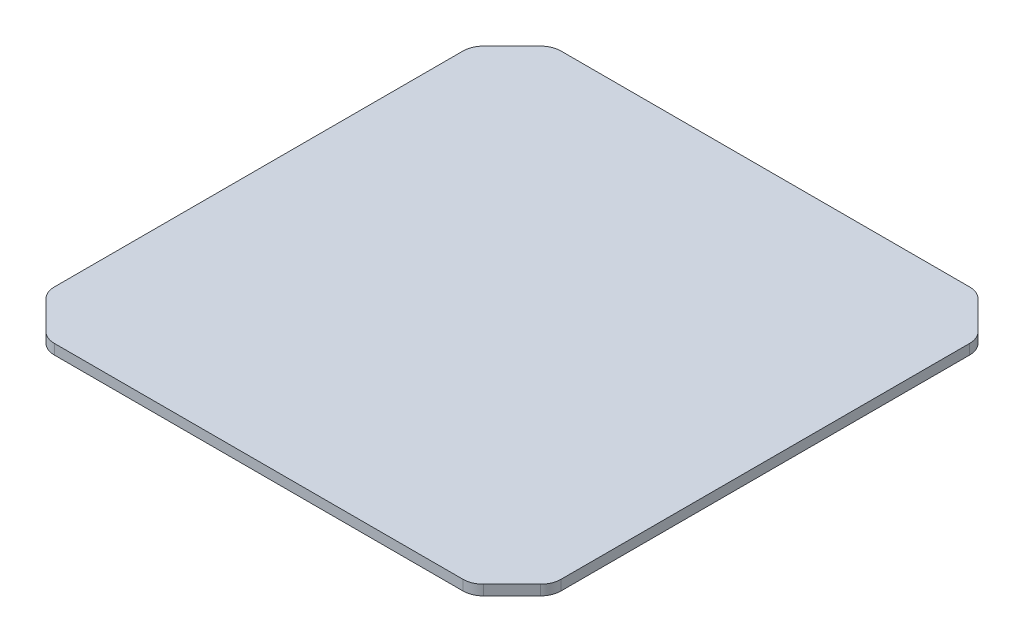
from build123d import *

# Parameters (mm, degrees)
SKETCH1_W           = 250
SKETCH1_H           = 250
BOSS_EXTRUDE1_DEPTH = 5
CHAMFER1_SIZE       = 20
FILLET2_R           = 10


with BuildPart() as part:
    # Sketch1 → Boss-Extrude1 (new body)
    with BuildSketch(Plane(origin=(0, 0, 0), x_dir=(1, 0, 0), z_dir=(0, 1, 0))):
        Rectangle(SKETCH1_W, SKETCH1_H)
    extrude(amount=BOSS_EXTRUDE1_DEPTH)

    # Chamfer1
    chamfer1_edges = [part.edges().sort_by_distance(p)[0] for p in [
        (125, 2.5, 125),
        (-125, 2.5, 125),
        (-125, 2.5, -125),
        (125, 2.5, -125),
    ]]
    chamfer(chamfer1_edges, length=CHAMFER1_SIZE)

    # Fillet2
    fillet2_edges = [part.edges().sort_by_distance(p)[0] for p in [
        (-105, 2.5, -125),
        (105, 2.5, -125),
        (125, 2.5, 105),
        (125, 2.5, -105),
        (-105, 2.5, 125),
        (105, 2.5, 125),
        (-125, 2.5, -105),
        (-125, 2.5, 105),
    ]]
    fillet(fillet2_edges, radius=FILLET2_R)


solid = part.part
